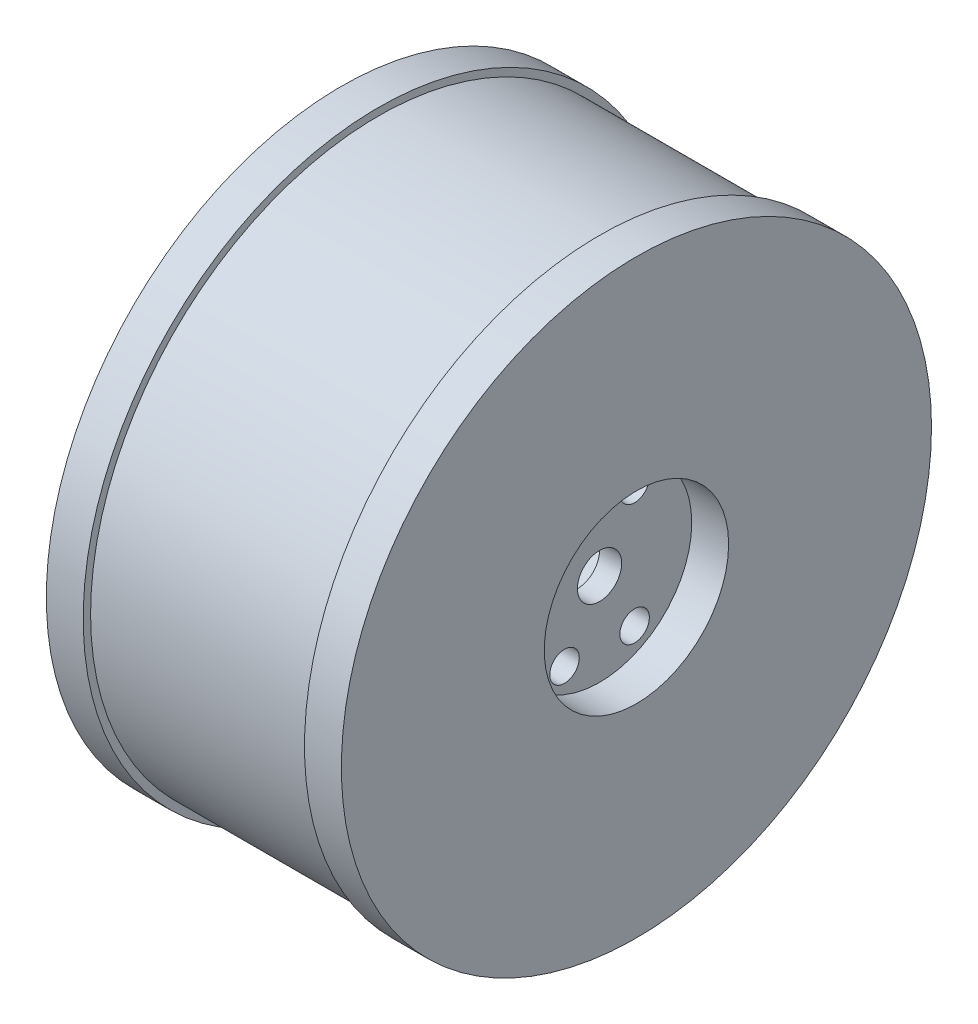
from build123d import *

# Parameters (mm, degrees)
ESQUISSE2_W             = 5
ESQUISSE2_H             = 12.5
ESQUISSE3_R             = 2
ENL_V_MAT_EXTRU_1_DEPTH = 67.520673478
ESQUISSE4_R             = 3
ENL_V_MAT_EXTRU_2_DEPTH = 67.520673478


with BuildPart() as part:
    # Esquisse1 → Révolution1 (revolve)
    with BuildSketch(Plane.XY, mode=Mode.PRIVATE) as r_volution1_sk:
        Polygon((0, 34), (0, 0), (8, 0), (8, 40), (3, 40), (3, 39), (-27, 39), (-27, 40), (-32, 40), (-32, 34), align=None)
    revolve(r_volution1_sk.sketch.rotate(Axis((-49.644499027, 0, 0), (1, 0, 0)), 90), axis=Axis((-49.644499027, 0, 0), (1, 0, 0)))

    # Esquisse2 → Enlèvement de matière-Révolution1 (revolve, cut)
    with BuildSketch(Plane.XY, mode=Mode.PRIVATE) as enl_vement_de_mati_re_r_volution1_sk:
        with Locations((5.5, 6.25)):
            Rectangle(ESQUISSE2_W, ESQUISSE2_H)
    revolve(enl_vement_de_mati_re_r_volution1_sk.sketch.rotate(Axis((0, 0, 0), (1, 0, 0)), 90), axis=Axis((0, 0, 0), (1, 0, 0)), mode=Mode.SUBTRACT)

    # Esquisse3 → Enlèv. mat.-Extru.1 (cut, through all)
    with BuildSketch(Plane(origin=(3, 0, 0), x_dir=(0, 0, -1), z_dir=(1, 0, 0))):
        with Locations((4.75, 8.227241336)):
            Circle(ESQUISSE3_R)
        with Locations((-4.75, 8.227241336)):
            Circle(ESQUISSE3_R)
        with Locations((4.75, -8.227241336)):
            Circle(ESQUISSE3_R)
        with Locations((-4.75, -8.227241336)):
            Circle(ESQUISSE3_R)
    extrude(amount=-ENL_V_MAT_EXTRU_1_DEPTH, mode=Mode.SUBTRACT)

    # Esquisse4 → Enlèv. mat.-Extru.2 (cut, through all)
    with BuildSketch(Plane(origin=(3, 0, 0), x_dir=(0, 0, -1), z_dir=(1, 0, 0))):
        Circle(ESQUISSE4_R)
    extrude(amount=-ENL_V_MAT_EXTRU_2_DEPTH, mode=Mode.SUBTRACT)


solid = part.part
